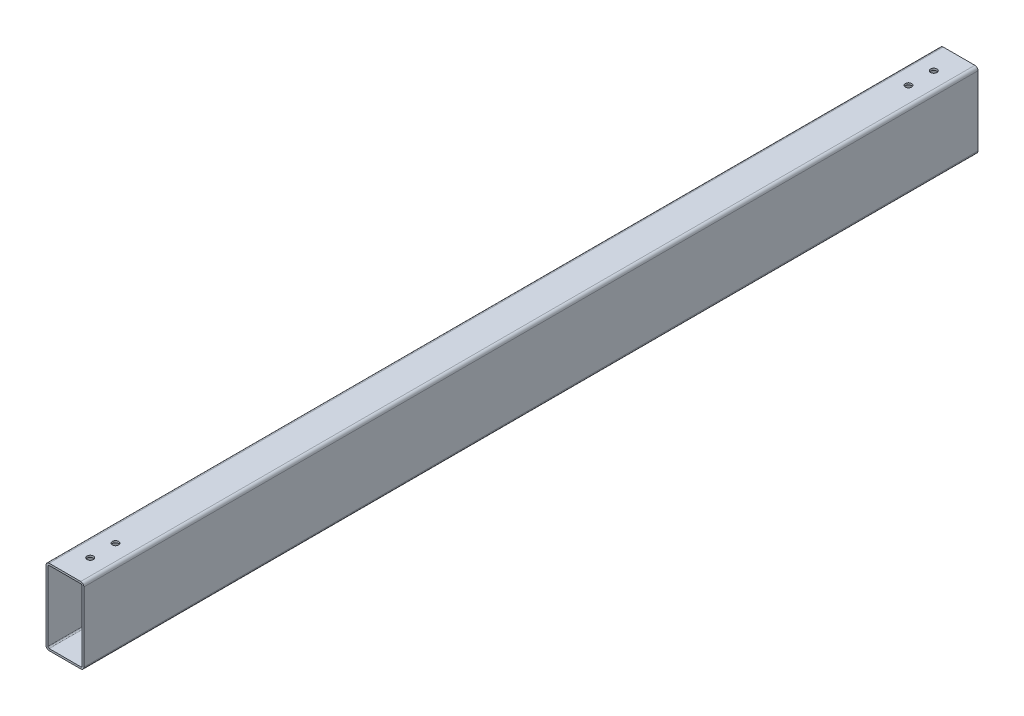
from build123d import *

# Parameters (mm, degrees)
EXTRUDE_THIN1_DEPTH      = 708
EXTRUDE_THIN1_DEPTH_BACK = 708
CUT_EXTRUDE1_REACH       = 720.724
SKETCH3_R                = 5


with BuildPart() as part:
    # Sketch2 → Extrude-Thin1 (new, two sides: drawn at the far end of the back side and taken through both)
    with BuildSketch(Plane.XY.offset(-EXTRUDE_THIN1_DEPTH_BACK)):
        with BuildLine():
            Line((-25, -60), (25, -60))
            ThreePointArc((25, -60), (28.535533906, -58.535533906), (30, -55))
            Line((30, -55), (30, 55))
            ThreePointArc((30, 55), (28.535533906, 58.535533906), (25, 60))
            Line((25, 60), (-25, 60))
            ThreePointArc((-25, 60), (-28.535533906, 58.535533906), (-30, 55))
            Line((-30, 55), (-30, -55))
            ThreePointArc((-30, -55), (-28.535533906, -58.535533906), (-25, -60))
        make_face()
        with BuildLine():
            Line((-25, -57), (25, -57))
            ThreePointArc((25, -57), (26.414213562, -56.414213562), (27, -55))
            Line((27, -55), (27, 55))
            ThreePointArc((27, 55), (26.414213562, 56.414213562), (25, 57))
            Line((25, 57), (-25, 57))
            ThreePointArc((-25, 57), (-26.414213562, 56.414213562), (-27, 55))
            Line((-27, 55), (-27, -55))
            ThreePointArc((-27, -55), (-26.414213562, -56.414213562), (-25, -57))
        make_face(mode=Mode.SUBTRACT)
    extrude(amount=EXTRUDE_THIN1_DEPTH + EXTRUDE_THIN1_DEPTH_BACK)

    # Sketch3 → Cut-Extrude1 (cut, up to next)
    with BuildSketch(Plane(origin=(0, 60, 0), x_dir=(1, 0, 0), z_dir=(0, 1, 0)), mode=Mode.PRIVATE) as cut_extrude1_sk1:
        with Locations(Location((0, 668, 0), (0, 0, 270))):
            Circle(SKETCH3_R)
    cut_extrude1_tool1 = extrude(cut_extrude1_sk1.sketch, amount=-CUT_EXTRUDE1_REACH, mode=Mode.PRIVATE) & part.part
    # Sketch3 → Cut-Extrude1 (cut, up to next)
    with BuildSketch(Plane(origin=(0, 60, 0), x_dir=(1, 0, 0), z_dir=(0, 1, 0)), mode=Mode.PRIVATE) as cut_extrude1_sk2:
        with Locations(Location((0, 628, 0), (0, 0, 270))):
            Circle(SKETCH3_R)
    cut_extrude1_tool2 = extrude(cut_extrude1_sk2.sketch, amount=-CUT_EXTRUDE1_REACH, mode=Mode.PRIVATE) & part.part
    # Sketch3 → Cut-Extrude1 (cut, up to next)
    with BuildSketch(Plane(origin=(0, 60, 0), x_dir=(1, 0, 0), z_dir=(0, 1, 0)), mode=Mode.PRIVATE) as cut_extrude1_sk3:
        with Locations(Location((0, -628, 0), (0, 0, 270))):
            Circle(SKETCH3_R)
    cut_extrude1_tool3 = extrude(cut_extrude1_sk3.sketch, amount=-CUT_EXTRUDE1_REACH, mode=Mode.PRIVATE) & part.part
    # Sketch3 → Cut-Extrude1 (cut, up to next)
    with BuildSketch(Plane(origin=(0, 60, 0), x_dir=(1, 0, 0), z_dir=(0, 1, 0)), mode=Mode.PRIVATE) as cut_extrude1_sk4:
        with Locations(Location((0, -668, 0), (0, 0, 270))):
            Circle(SKETCH3_R)
    cut_extrude1_tool4 = extrude(cut_extrude1_sk4.sketch, amount=-CUT_EXTRUDE1_REACH, mode=Mode.PRIVATE) & part.part
    add(cut_extrude1_tool1.solids().sort_by_distance((0, 60, -668))[0], mode=Mode.SUBTRACT)
    add(cut_extrude1_tool2.solids().sort_by_distance((0, 60, -628))[0], mode=Mode.SUBTRACT)
    add(cut_extrude1_tool3.solids().sort_by_distance((0, 60, 628))[0], mode=Mode.SUBTRACT)
    add(cut_extrude1_tool4.solids().sort_by_distance((0, 60, 668))[0], mode=Mode.SUBTRACT)


solid = part.part
